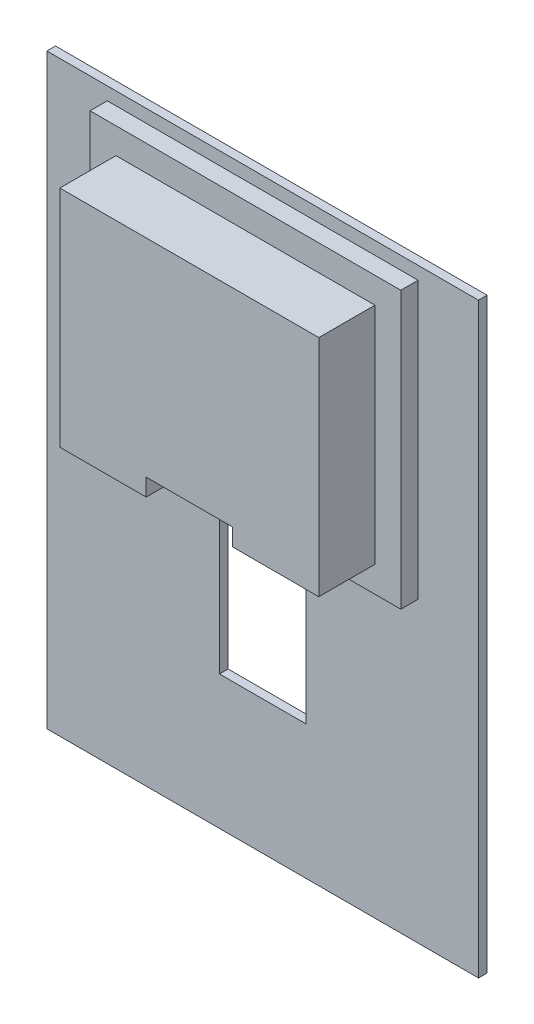
from build123d import *

# Parameters (mm, degrees)
BOSS_EXTRU_1_DEPTH      = 2
BOSS_EXTRU_2_DEPTH      = 4
ESQUISSE3_W             = 68
ESQUISSE3_H             = 60
ESQUISSE3_W_2           = 56
ESQUISSE3_H_2           = 48
BOSS_EXTRU_3_DEPTH      = 2
ESQUISSE4_W             = 60
ESQUISSE4_H             = 52
ESQUISSE4_W_2           = 56
ESQUISSE4_H_2           = 48
BOSS_EXTRU_4_DEPTH      = 13
ESQUISSE5_W             = 56
ESQUISSE5_H             = 48
BOSS_EXTRU_5_DEPTH      = 2
ESQUISSE6_W             = 20
ESQUISSE6_H             = 10
ENL_V_MAT_EXTRU_1_DEPTH = 35


with BuildPart() as part:
    # Esquisse1 → Boss.-Extru.1 (new body)
    with BuildSketch(Plane.XY):
        Polygon((-50, 68), (-50, -68), (-10, -68), (10, -68), (50, -68), (50, 68), align=None)
        Polygon((-10, 3), (-34, 3), (-34, 63), (34, 63), (34, 3), (10, 3), (10, -37), (-10, -37), align=None, mode=Mode.SUBTRACT)
    extrude(amount=BOSS_EXTRU_1_DEPTH)

    # Esquisse2 → Boss.-Extru.2 (add)
    with BuildSketch(Plane.XY.offset(2)):
        Polygon((36, 65), (-36, 65), (-36, 1), (-10, 1), (-10, 3), (-34, 3), (-34, 63), (34, 63), (34, 3), (10, 3), (10, 1), (36, 1), align=None)
    extrude(amount=BOSS_EXTRU_2_DEPTH)

    # Esquisse3 → Boss.-Extru.3 (add)
    with BuildSketch(Plane.XY.offset(6)):
        with Locations((0, 33)):
            Rectangle(ESQUISSE3_W, ESQUISSE3_H)
        with Locations((0, 33)):
            Rectangle(ESQUISSE3_W_2, ESQUISSE3_H_2, mode=Mode.SUBTRACT)
    extrude(amount=-BOSS_EXTRU_3_DEPTH)

    # Esquisse4 → Boss.-Extru.4 (add)
    with BuildSketch(Plane.XY.offset(6)):
        with Locations((0, 33)):
            Rectangle(ESQUISSE4_W, ESQUISSE4_H)
        with Locations((0, 33)):
            Rectangle(ESQUISSE4_W_2, ESQUISSE4_H_2, mode=Mode.SUBTRACT)
    extrude(amount=BOSS_EXTRU_4_DEPTH)

    # Esquisse5 → Boss.-Extru.5 (add)
    with BuildSketch(Plane.XY.offset(19)):
        with Locations((0, 33)):
            Rectangle(ESQUISSE5_W, ESQUISSE5_H)
    extrude(amount=-BOSS_EXTRU_5_DEPTH)

    # Esquisse6 → Enlèv. mat.-Extru.1 (cut)
    with BuildSketch(Plane.XY.offset(19)):
        with Locations((0, 6)):
            Rectangle(ESQUISSE6_W, ESQUISSE6_H)
    extrude(amount=-ENL_V_MAT_EXTRU_1_DEPTH, mode=Mode.SUBTRACT)


solid = part.part
